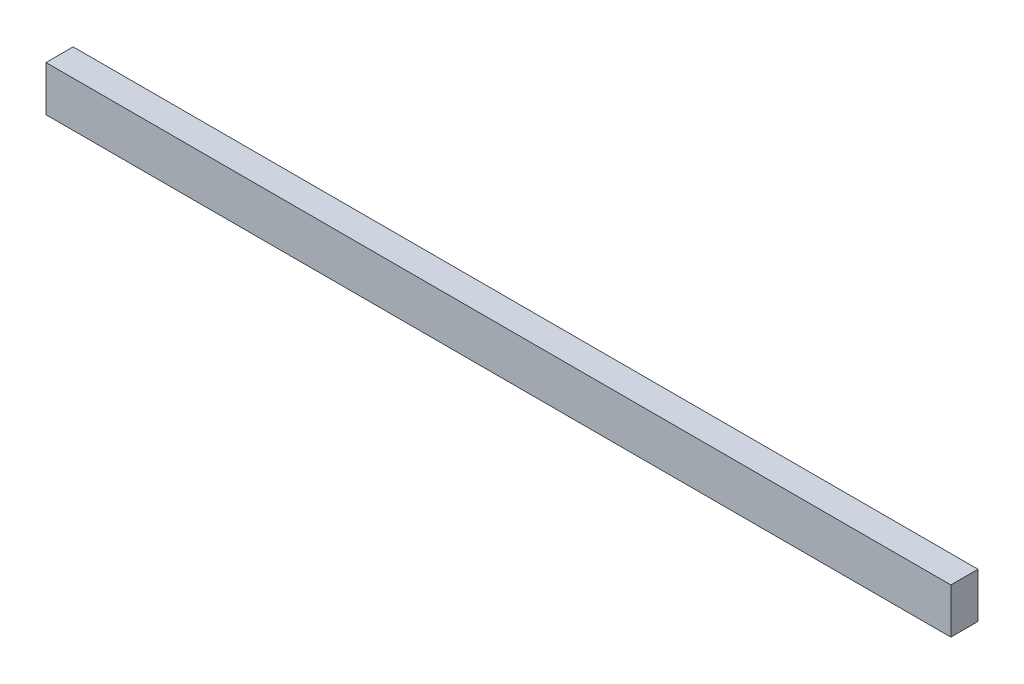
from build123d import *

# Parameters (mm, degrees)
SKETCH1_W           = 200
SKETCH1_H           = 10
BOSS_EXTRUDE1_DEPTH = 6


with BuildPart() as part:
    # Sketch1 → Boss-Extrude1 (new body)
    with BuildSketch(Plane.XY):
        with Locations((100, 5)):
            Rectangle(SKETCH1_W, SKETCH1_H)
    extrude(amount=BOSS_EXTRUDE1_DEPTH)


solid = part.part
